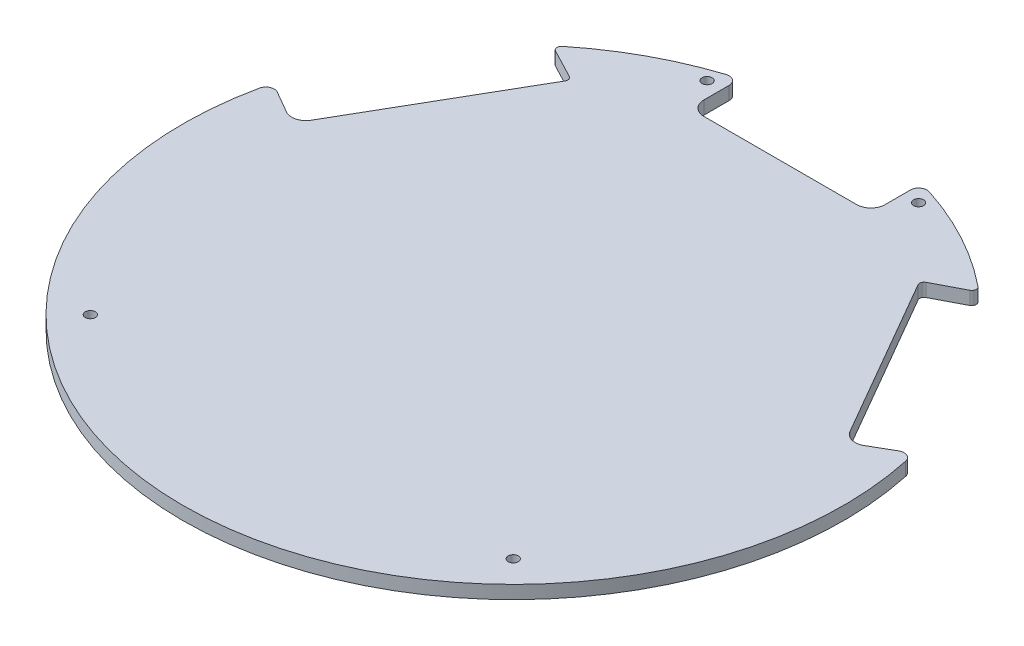
from build123d import *

# Parameters (mm, degrees)
SKETCH1_R           = 1.15
BOSS_EXTRUDE2_DEPTH = 3


with BuildPart() as part:
    # Sketch1 → Boss-Extrude2 (new body)
    with BuildSketch(Plane(origin=(0, 0, 0), x_dir=(1, 0, 0), z_dir=(0, 1, 0))):
        with BuildLine():
            Line((17.353017405, 60.60705136), (-17.353017405, 60.60705136))
            ThreePointArc((-17.353017405, 60.60705136), (-19.629383429, 61.54995304), (-20.572285109, 63.826319064))
            Line((-20.572285109, 63.826319064), (-20.572285109, 69.573042322))
            ThreePointArc((-20.572285109, 69.573042322), (-21.350187318, 71.101515686), (-23.043737047, 71.372166724))
            ThreePointArc((-23.043737047, 71.372166724), (-25.323501925, 70.595469049), (-27.577152814, 69.745972233))
            ThreePointArc((-27.577152814, 69.745972233), (-37.5, 64.951905284), (-46.613207358, 58.755501017))
            ThreePointArc((-46.613207358, 58.755501017), (-46.906411899, 58.521692754), (-47.198443695, 58.286421342))
            ThreePointArc((-47.198443695, 58.286421342), (-47.564165172, 57.409734041), (-47.032034758, 56.622860452))
            Line((-47.032034758, 56.622860452), (-40.472942236, 53.197546407))
            ThreePointArc((-40.472942236, 53.197546407), (-39.975613978, 52.590341474), (-40.069820478, 51.811137802))
            Line((-40.069820478, 51.811137802), (-61.163754829, 15.275371775))
            ThreePointArc((-61.163754829, 15.275371775), (-63.118514649, 13.77543181), (-65.561356294, 14.097038013))
            Line((-65.561356294, 14.097038013), (-70.538164624, 16.970399642))
            ThreePointArc((-70.538164624, 16.970399642), (-72.250812491, 17.06095325), (-73.33197803, 15.729621681))
            ThreePointArc((-73.33197803, 15.729621681), (-73.799220551, 13.366938545), (-74.190360172, 10.990471215))
            ThreePointArc((-74.190360172, 10.990471215), (-75, 0), (-74.190360172, -10.990471215))
            ThreePointArc((-74.190360172, -10.990471215), (-73.794140163, -13.394957173), (-73.320012655, -15.785301525))
            ThreePointArc((-73.320012655, -15.785301525), (-64.937662855, -37.524657799), (-50.288240982, -55.642545043))
            ThreePointArc((-50.288240982, -55.642545043), (-48.475718626, -57.228530504), (-46.613207358, -58.755501017))
            ThreePointArc((-46.613207358, -58.755501017), (-37.5, -64.951905284), (-27.577152814, -69.745972233))
            ThreePointArc((-27.577152814, -69.745972233), (-25.296696887, -70.605078618), (-22.989534201, -71.389644328))
            ThreePointArc((-22.989534201, -71.389644328), (0.028475495, -74.999994594), (23.043737047, -71.372166724))
            ThreePointArc((23.043737047, -71.372166724), (25.323501925, -70.595469049), (27.577152814, -69.745972233))
            ThreePointArc((27.577152814, -69.745972233), (37.5, -64.951905284), (46.613207358, -58.755501017))
            ThreePointArc((46.613207358, -58.755501017), (48.497443275, -57.210121445), (50.330478454, -55.604342803))
            ThreePointArc((50.330478454, -55.604342803), (64.96613835, -37.475336795), (73.33197803, -15.729621681))
            ThreePointArc((73.33197803, -15.729621681), (73.799220551, -13.366938545), (74.190360172, -10.990471215))
            ThreePointArc((74.190360172, -10.990471215), (75, 0), (74.190360172, 10.990471215))
            ThreePointArc((74.190360172, 10.990471215), (73.799220551, 13.366938545), (73.33197803, 15.729621681))
            ThreePointArc((73.33197803, 15.729621681), (72.250812491, 17.06095325), (70.538164624, 16.970399642))
            Line((70.538164624, 16.970399642), (65.561356294, 14.097038013))
            ThreePointArc((65.561356294, 14.097038013), (63.118514649, 13.77543181), (61.163754829, 15.275371775))
            Line((61.163754829, 15.275371775), (43.810737424, 45.331679586))
            Line((43.810737424, 45.331679586), (40.069820478, 51.811137802))
            ThreePointArc((40.069820478, 51.811137802), (39.975613978, 52.590341474), (40.472942236, 53.197546407))
            Line((40.472942236, 53.197546407), (47.032034758, 56.622860452))
            ThreePointArc((47.032034758, 56.622860452), (47.564165172, 57.409734041), (47.198443695, 58.286421342))
            ThreePointArc((47.198443695, 58.286421342), (46.906411899, 58.521692754), (46.613207358, 58.755501017))
            ThreePointArc((46.613207358, 58.755501017), (37.5, 64.951905284), (27.577152814, 69.745972233))
            ThreePointArc((27.577152814, 69.745972233), (25.323501925, 70.595469049), (23.043737047, 71.372166724))
            ThreePointArc((23.043737047, 71.372166724), (21.350187318, 71.101515686), (20.572285109, 69.573042322))
            Line((20.572285109, 69.573042322), (20.572285109, 63.826319064))
            ThreePointArc((20.572285109, 63.826319064), (19.629383429, 61.54995304), (17.353017405, 60.60705136))
        make_face()
        with Locations(Location((-48, -48, 0), (0, 0, 270))):
            Circle(SKETCH1_R, mode=Mode.SUBTRACT)
        with Locations(Location((48, -48, 0), (0, 0, 270))):
            Circle(SKETCH1_R, mode=Mode.SUBTRACT)
        with Locations(Location((-24, 68, 0), (0, 0, 270))):
            Circle(SKETCH1_R, mode=Mode.SUBTRACT)
        with Locations(Location((24, 68, 0), (0, 0, 270))):
            Circle(SKETCH1_R, mode=Mode.SUBTRACT)
    extrude(amount=BOSS_EXTRUDE2_DEPTH)


solid = part.part
